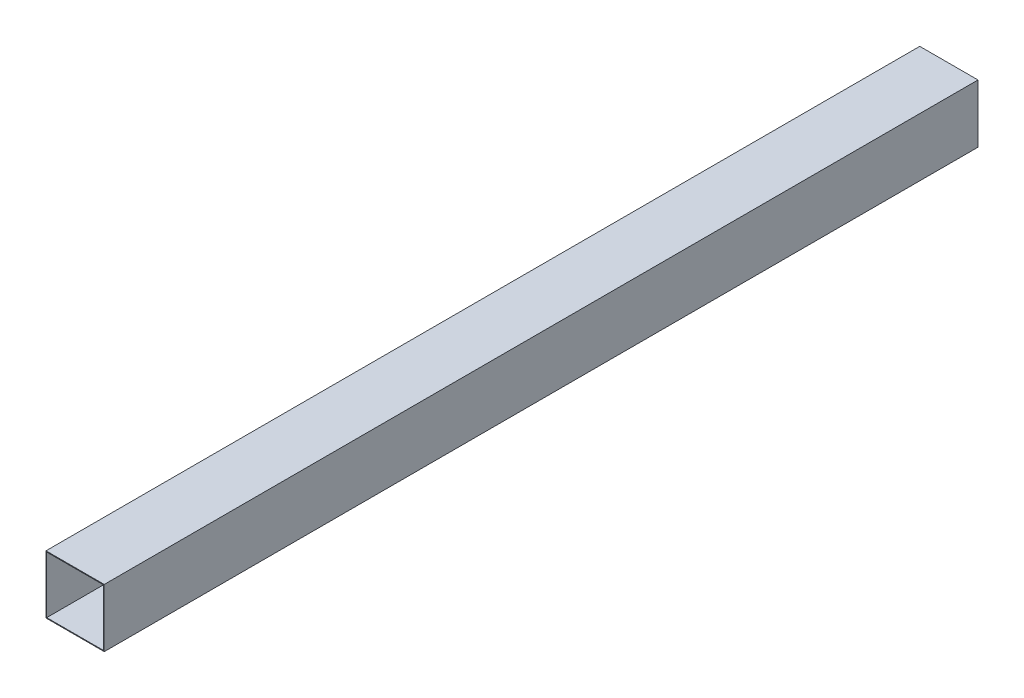
from build123d import *

# Parameters (mm, degrees)
CROQUIS1_W              = 40
CROQUIS1_H              = 40
CROQUIS1_W_2            = 39
CROQUIS1_H_2            = 39
SALIENTE_EXTRUIR1_DEPTH = 600


with BuildPart() as part:
    # Croquis1 → Saliente-Extruir1 (new body)
    with BuildSketch(Plane.XY):
        Rectangle(CROQUIS1_W, CROQUIS1_H)
        Rectangle(CROQUIS1_W_2, CROQUIS1_H_2, mode=Mode.SUBTRACT)
    extrude(amount=SALIENTE_EXTRUIR1_DEPTH)


solid = part.part
